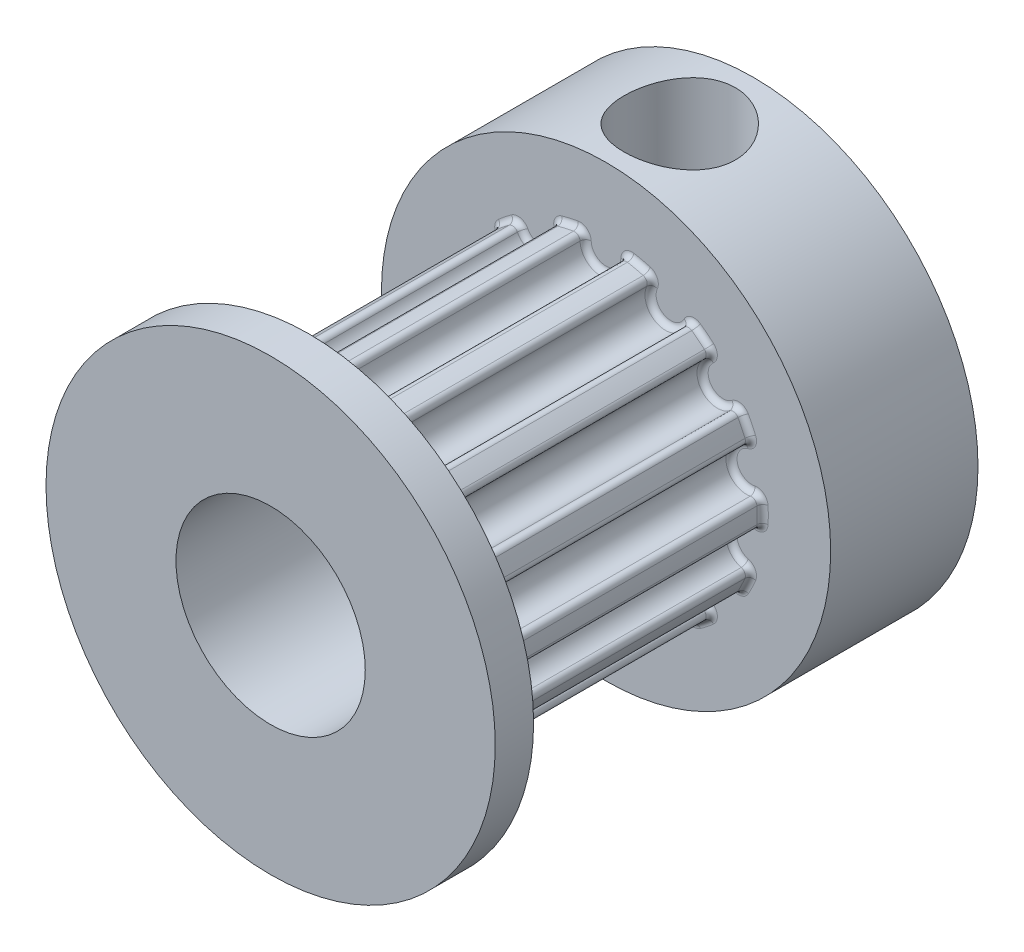
from build123d import *

# Parameters (mm, degrees)
CUT_EXTRUDE2_DEPTH = 8
FILLET1_R          = 0.15
SKETCH3_R          = 1.5
CUT_EXTRUDE3_DEPTH = 10


with BuildPart() as part:
    # Sketch1 → Revolve1 (revolve)
    with BuildSketch(Plane(origin=(0, 0, 0), x_dir=(0, 0, -1), z_dir=(1, 0, 0)), mode=Mode.PRIVATE) as revolve1_sk:
        Polygon((0, 6.048757987), (1.032305684, 6.048757987), (1.032305684, 4.219335944), (9.032305684, 4.219335944), (9.032305684, 6.048757987), (13, 6.048757987), (13, 2.548757987), (0, 2.548757987), align=None)
    revolve(revolve1_sk.sketch.rotate(Axis((0, 0, 0), (0, 0, -1)), 90), axis=Axis((0, 0, 0), (0, 0, -1)))

    # Sketch2 → Cut-Extrude2 (cut)
    with BuildSketch(Plane.XY.offset(-9.032305684)):
        with BuildLine():
            ThreePointArc((-2.944302265, 3.022230961), (-3.298809676, 2.630712932), (-3.601626211, 2.197972804))
            ThreePointArc((-3.601626211, 2.197972804), (-2.720254379, 2.169330478), (-2.944302265, 3.022230961))
        make_face()
        with BuildLine():
            ThreePointArc((-0.527132876, 4.186278388), (0, 3.479335944), (0.527132876, 4.186278388))
            ThreePointArc((0.527132876, 4.186278388), (0, 4.219335944), (-0.527132876, 4.186278388))
        make_face()
        with BuildLine():
            ThreePointArc((1.341427809, 4.000420883), (1.509627289, 3.134773367), (2.291288431, 3.542992116))
            ThreePointArc((2.291288431, 3.542992116), (1.830701256, 3.801490329), (1.341427809, 4.000420883))
        make_face()
        with BuildLine():
            ThreePointArc((2.944302265, 3.022230961), (2.720254379, 2.169330478), (3.601626211, 2.197972804))
            ThreePointArc((3.601626211, 2.197972804), (3.298809676, 2.630712932), (2.944302265, 3.022230961))
        make_face()
        with BuildLine():
            ThreePointArc((3.964021549, 1.445451131), (3.392101728, 0.774225084), (4.198617748, 0.417618022))
            ThreePointArc((4.198617748, 0.417618022), (4.113548383, 0.938890575), (3.964021549, 1.445451131))
        make_face()
        with BuildLine():
            ThreePointArc((4.198617748, -0.417618022), (3.392101728, -0.774225084), (3.964021549, -1.445451131))
            ThreePointArc((3.964021549, -1.445451131), (4.113548383, -0.938890575), (4.198617748, -0.417618022))
        make_face()
        with BuildLine():
            ThreePointArc((3.601626211, -2.197972804), (2.720254379, -2.169330478), (2.944302265, -3.022230961))
            ThreePointArc((2.944302265, -3.022230961), (3.298809676, -2.630712932), (3.601626211, -2.197972804))
        make_face()
        with BuildLine():
            ThreePointArc((2.291288431, -3.542992116), (1.509627289, -3.134773367), (1.341427809, -4.000420883))
            ThreePointArc((1.341427809, -4.000420883), (1.830701256, -3.801490329), (2.291288431, -3.542992116))
        make_face()
        with BuildLine():
            ThreePointArc((0.527132876, -4.186278388), (0, -3.479335944), (-0.527132876, -4.186278388))
            ThreePointArc((-0.527132876, -4.186278388), (0, -4.219335944), (0.527132876, -4.186278388))
        make_face()
        with BuildLine():
            ThreePointArc((-1.341427809, -4.000420883), (-1.509627289, -3.134773367), (-2.291288431, -3.542992116))
            ThreePointArc((-2.291288431, -3.542992116), (-1.830701256, -3.801490329), (-1.341427809, -4.000420883))
        make_face()
        with BuildLine():
            ThreePointArc((-2.944302265, -3.022230961), (-2.720254379, -2.169330478), (-3.601626211, -2.197972804))
            ThreePointArc((-3.601626211, -2.197972804), (-3.298809676, -2.630712932), (-2.944302265, -3.022230961))
        make_face()
        with BuildLine():
            ThreePointArc((-3.964021549, -1.445451131), (-3.392101728, -0.774225084), (-4.198617748, -0.417618022))
            ThreePointArc((-4.198617748, -0.417618022), (-4.113548383, -0.938890575), (-3.964021549, -1.445451131))
        make_face()
        with BuildLine():
            ThreePointArc((-4.198617748, 0.417618022), (-3.392101728, 0.774225084), (-3.964021549, 1.445451131))
            ThreePointArc((-3.964021549, 1.445451131), (-4.113548383, 0.938890575), (-4.198617748, 0.417618022))
        make_face()
        with BuildLine():
            ThreePointArc((-2.291288431, 3.542992116), (-1.509627289, 3.134773367), (-1.341427809, 4.000420883))
            ThreePointArc((-1.341427809, 4.000420883), (-1.830701256, 3.801490329), (-2.291288431, 3.542992116))
        make_face()
    extrude(amount=CUT_EXTRUDE2_DEPTH, mode=Mode.SUBTRACT)

    # Fillet1
    fillet1_edges = [part.edges().sort_by_distance(p)[0] for p in [
        (3.801490329, 1.830701256, -1.032305684),
        (2.630712932, 3.298809676, -1.032305684),
        (0.938890575, 4.113548383, -1.032305684),
        (-0.938890575, 4.113548383, -1.032305684),
        (-2.630712932, 3.298809676, -1.032305684),
        (-3.801490329, 1.830701256, -1.032305684),
        (-4.219335944, 0, -1.032305684),
        (-3.801490329, -1.830701256, -1.032305684),
        (-2.630712932, -3.298809676, -1.032305684),
        (-0.938890575, -4.113548383, -1.032305684),
        (0.938890575, -4.113548383, -1.032305684),
        (2.630712932, -3.298809676, -1.032305684),
        (3.801490329, -1.830701256, -1.032305684),
        (4.219335944, 0, -1.032305684),
        (3.801490329, 1.830701256, -9.032305684),
        (2.630712932, 3.298809676, -9.032305684),
        (0.938890575, 4.113548383, -9.032305684),
        (-0.938890575, 4.113548383, -9.032305684),
        (-2.630712932, 3.298809676, -9.032305684),
        (-3.801490329, 1.830701256, -9.032305684),
        (-4.219335944, 0, -9.032305684),
        (-3.801490329, -1.830701256, -9.032305684),
        (-2.630712932, -3.298809676, -9.032305684),
        (-0.938890575, -4.113548383, -9.032305684),
        (0.938890575, -4.113548383, -9.032305684),
        (2.630712932, -3.298809676, -9.032305684),
        (3.801490329, -1.830701256, -9.032305684),
        (4.219335944, 0, -9.032305684),
        (2.291288431, 3.542992116, -5.032305684),
        (1.341427809, 4.000420883, -5.032305684),
        (1.509627289, 3.134773367, -9.032305684),
        (1.509627289, 3.134773367, -1.032305684),
        (3.601626211, 2.197972804, -5.032305684),
        (2.944302265, 3.022230961, -5.032305684),
        (2.720254379, 2.169330478, -9.032305684),
        (2.720254379, 2.169330478, -1.032305684),
        (4.198617748, 0.417618022, -5.032305684),
        (3.964021549, 1.445451131, -5.032305684),
        (3.392101728, 0.774225084, -9.032305684),
        (3.392101728, 0.774225084, -1.032305684),
        (3.964021549, -1.445451131, -5.032305684),
        (4.198617748, -0.417618022, -5.032305684),
        (3.392101728, -0.774225084, -9.032305684),
        (3.392101728, -0.774225084, -1.032305684),
        (2.944302265, -3.022230961, -5.032305684),
        (3.601626211, -2.197972804, -5.032305684),
        (2.720254379, -2.169330478, -9.032305684),
        (2.720254379, -2.169330478, -1.032305684),
        (1.341427809, -4.000420883, -5.032305684),
        (2.291288431, -3.542992116, -5.032305684),
        (1.509627289, -3.134773367, -9.032305684),
        (1.509627289, -3.134773367, -1.032305684),
        (-0.527132876, -4.186278388, -5.032305684),
        (0.527132876, -4.186278388, -5.032305684),
        (0, -3.479335944, -9.032305684),
        (0, -3.479335944, -1.032305684),
        (-2.291288431, -3.542992116, -5.032305684),
        (-1.341427809, -4.000420883, -5.032305684),
        (-1.509627289, -3.134773367, -9.032305684),
        (-1.509627289, -3.134773367, -1.032305684),
        (-3.601626211, -2.197972804, -5.032305684),
        (-2.944302265, -3.022230961, -5.032305684),
        (-2.720254379, -2.169330478, -9.032305684),
        (-2.720254379, -2.169330478, -1.032305684),
        (-4.198617748, -0.417618022, -5.032305684),
        (-3.964021549, -1.445451131, -5.032305684),
        (-3.392101728, -0.774225084, -9.032305684),
        (-3.392101728, -0.774225084, -1.032305684),
        (-3.964021549, 1.445451131, -5.032305684),
        (-4.198617748, 0.417618022, -5.032305684),
        (-3.392101728, 0.774225084, -9.032305684),
        (-3.392101728, 0.774225084, -1.032305684),
        (-3.601626211, 2.197972804, -5.032305684),
        (-2.720254379, 2.169330478, -9.032305684),
        (-2.944302265, 3.022230961, -5.032305684),
        (-2.720254379, 2.169330478, -1.032305684),
        (-1.341427809, 4.000420883, -5.032305684),
        (-2.291288431, 3.542992116, -5.032305684),
        (-1.509627289, 3.134773367, -9.032305684),
        (-1.509627289, 3.134773367, -1.032305684),
        (0.527132876, 4.186278388, -5.032305684),
        (-0.527132876, 4.186278388, -5.032305684),
        (0, 3.479335944, -9.032305684),
        (0, 3.479335944, -1.032305684),
    ]]
    fillet(fillet1_edges, radius=FILLET1_R)

    # Sketch3 → Cut-Extrude3 (cut)
    with BuildSketch(Plane(origin=(0, 0, 0), x_dir=(1, 0, 0), z_dir=(0, 1, 0))):
        with Locations(Location((0, 11.016152842, 0), (0, 0, 90))):
            Circle(SKETCH3_R)
    extrude(amount=CUT_EXTRUDE3_DEPTH, mode=Mode.SUBTRACT)


solid = part.part
